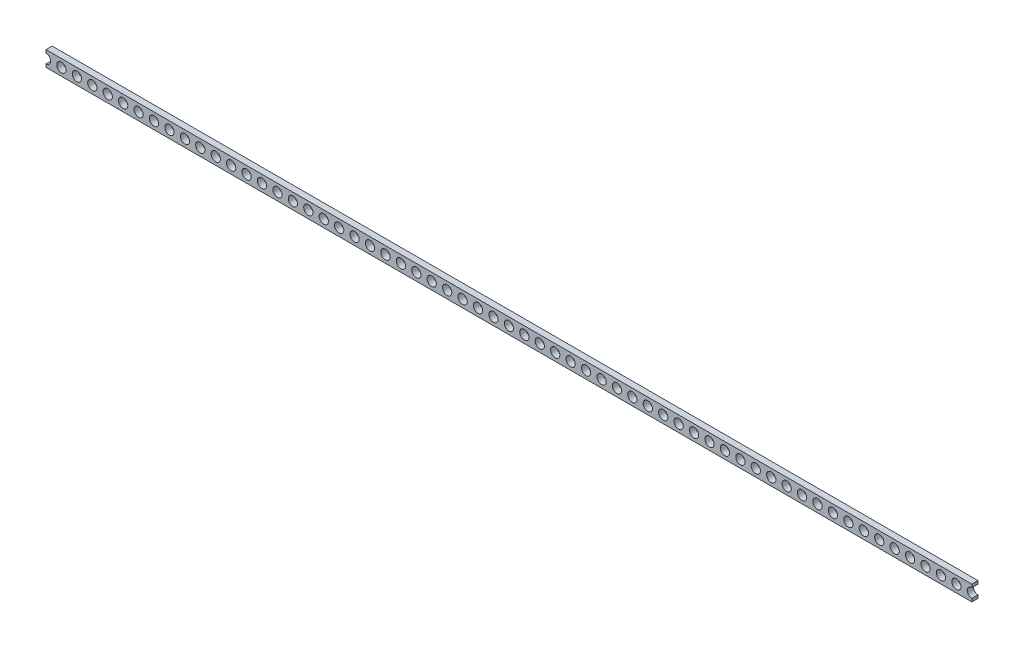
from build123d import *

# Parameters (mm, degrees)
SKETCH_1_W             = 300
SKETCH_1_H             = 5
EXTRUDE_1_DEPTH        = 2
SKETCH_2_R             = 1.5
CUT_EXTRUDE_1_DEPTH    = 301.04832944
PATTERN_LINEAR_1_COUNT = 41
PATTERN_LINEAR_1_PITCH = 5
PATTERN_LINEAR_2_COUNT = 41
PATTERN_LINEAR_2_PITCH = 5


with BuildPart() as part:
    # 草图1 → 凸台-拉伸1 (new body)
    with BuildSketch(Plane.XY):
        with Locations((150, -2.5)):
            Rectangle(SKETCH_1_W, SKETCH_1_H)
    extrude(amount=EXTRUDE_1_DEPTH)

    # 草图2 → 切除-拉伸1 (cut, through all)
    with BuildSketch(Plane.XY.offset(2)):
        with Locations((150, -2.5)):
            Circle(SKETCH_2_R)
    cut_extrude_1 = extrude(amount=-CUT_EXTRUDE_1_DEPTH, mode=Mode.SUBTRACT)

    # 阵列(线性)1: 切除-拉伸1 ×41
    with Locations(*[(i * PATTERN_LINEAR_1_PITCH, 0, 0) for i in range(1, PATTERN_LINEAR_1_COUNT)]):
        add(cut_extrude_1, mode=Mode.SUBTRACT)

    # 阵列(线性)2: 切除-拉伸1 ×41
    with Locations(*[(-i * PATTERN_LINEAR_2_PITCH, 0, 0) for i in range(1, PATTERN_LINEAR_2_COUNT)]):
        add(cut_extrude_1, mode=Mode.SUBTRACT)


solid = part.part
